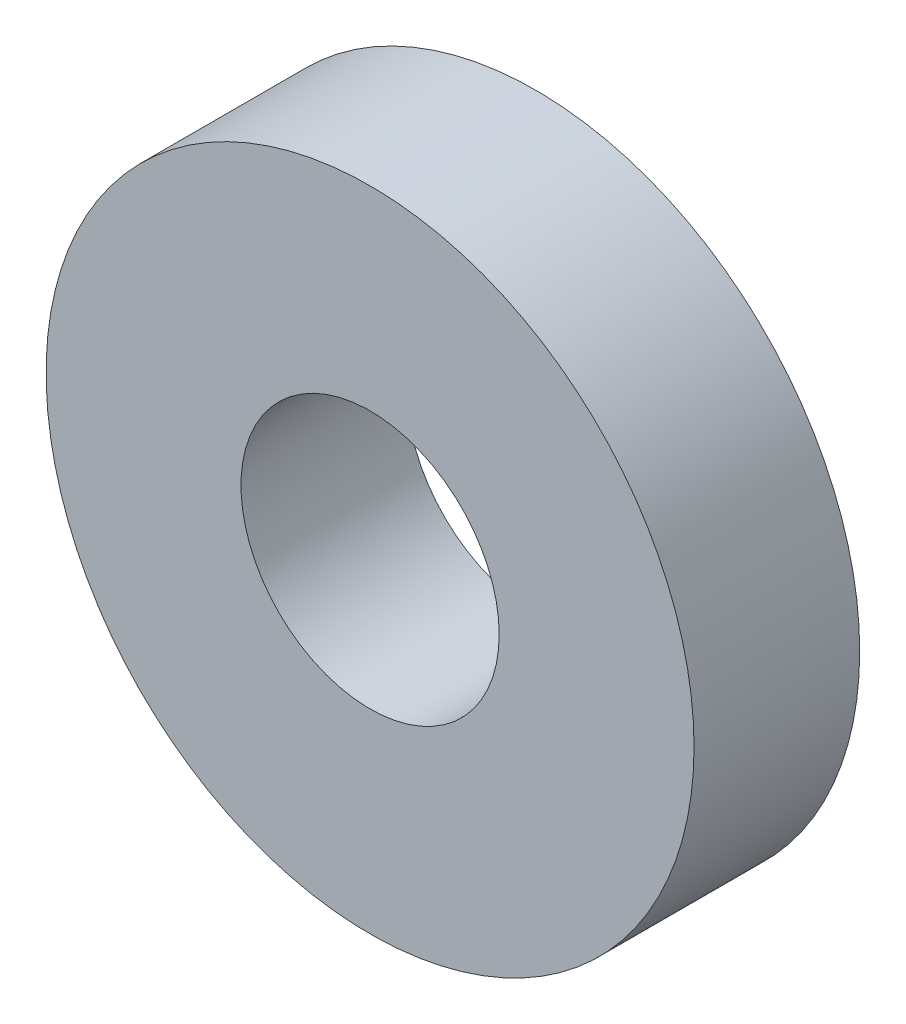
from build123d import *

# Parameters (mm, degrees)
ESQUISSE1_R        = 6.65
ESQUISSE1_R_2      = 2.65
BOSS_EXTRU_1_DEPTH = 3.4


with BuildPart() as part:
    # Esquisse1 → Boss.-Extru.1 (new body)
    with BuildSketch(Plane.XY):
        Circle(ESQUISSE1_R)
        Circle(ESQUISSE1_R_2, mode=Mode.SUBTRACT)
    extrude(amount=BOSS_EXTRU_1_DEPTH)


solid = part.part
